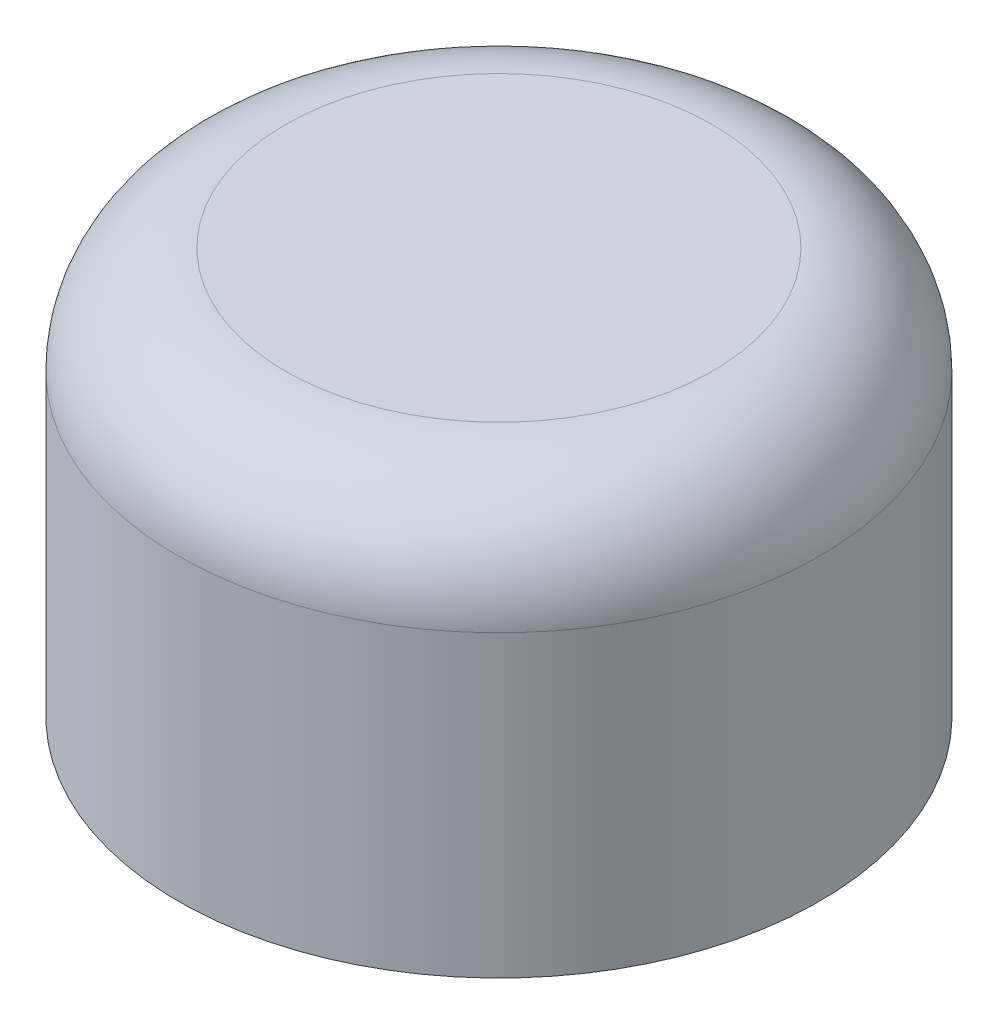
from build123d import *


with BuildPart() as part:
    # ｽｹｯﾁ1 → 回転1 (revolve)
    with BuildSketch(Plane.XY, mode=Mode.PRIVATE) as revolve_1_sk:
        with BuildLine():
            Line((0, 20), (10, 20))
            ThreePointArc((10, 20), (13.535533906, 18.535533906), (15, 15))
            Line((15, 15), (15, 1))
            Line((15, 1), (13, 1))
            Line((13, 1), (13, 3.5))
            Line((13, 3.5), (0, 3.5))
            Line((0, 3.5), (0, 6.5))
            Line((0, 6.5), (13, 6.5))
            Line((13, 6.5), (13, 15))
            ThreePointArc((13, 15), (12.121320344, 17.121320344), (10, 18))
            Line((10, 18), (0, 18))
            Line((0, 18), (0, 20))
        make_face()
    revolve(revolve_1_sk.sketch.rotate(Axis((0, 3.5, 0), (0, 1, 0)), 90), axis=Axis((0, 3.5, 0), (0, 1, 0)))


solid = part.part
